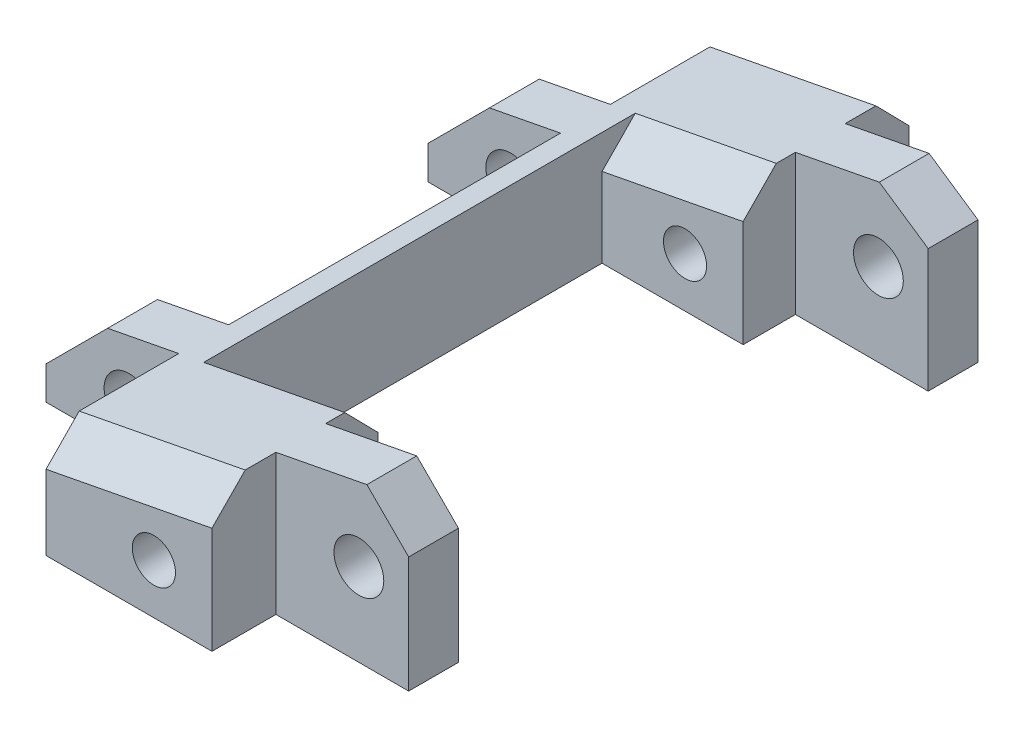
from build123d import *
from OCP.BRepFilletAPI import BRepFilletAPI_MakeChamfer

# Parameters (mm, degrees)
EXTRUDE_1_DEPTH     = 10
SKETCH_2_R          = 1.5
SKETCH_2_R_2        = 1.3
CUT_EXTRUDE_1_DEPTH = 46.08880127
CHAMFER_1_SIZE      = 3
CHAMFER_1_SIZE2     = 3.782343513
CHAMFER_1_SIZE2_2   = 2.562232702
CHAMFER_2_SIZE      = 2


with BuildPart() as part:
    # 草图1 → 凸台-拉伸1 (new body)
    with BuildSketch(Plane(origin=(0, 0, 0), x_dir=(1, 0, 0), z_dir=(0, 1, 0))):
        Polygon((13, -14.15), (5, -14.15), (5, -11), (-3.5, -11), (-3.5, 11), (5, 11), (5, 14.15), (13, 14.15), (13, 17.15), (5, 17.15), (5, 21), (-5, 21), (-5, 13), (-13, 13), (-13, 10), (-5, 10), (-5, -10), (-13, -10), (-13, -13), (-5, -13), (-5, -21), (5, -21), (5, -17.15), (13, -17.15), align=None)
    extrude(amount=EXTRUDE_1_DEPTH)

    # 草图2 → 切除-拉伸1 (cut, through all)
    with BuildSketch(Plane.XY.offset(21)):
        with Locations((10, 5)):
            Circle(SKETCH_2_R)
        with Locations((-8, 2.5)):
            Circle(SKETCH_2_R)
        with Locations((1.5, 3)):
            Circle(SKETCH_2_R_2)
        Polygon((-13, 5), (13, 10), (-13, 10), align=None)
    extrude(amount=-CUT_EXTRUDE_1_DEPTH, mode=Mode.SUBTRACT)

    # 倒角1: one chamfer whose edges measure the first distance from different faces: ONE call of the kernel's chamfer builder (chamfer() names one face for all edges)
    chamfer_1_edges_1 = [part.edges().sort_by_distance(p)[0] for p in [
        (-13, 5, -11.5),
    ]]
    chamfer_1_side_1 = [part.faces().sort_by_distance(p)[0] for p in [
        (-13, 2.5, -11.5),
    ]]
    chamfer_1_edges_2 = [part.edges().sort_by_distance(p)[0] for p in [
        (-13, 5, 11.5),
    ]]
    chamfer_1_side_2 = [part.faces().sort_by_distance(p)[0] for p in [
        (-13, 2.5, 11.5),
    ]]
    chamfer_1_edges_3 = [part.edges().sort_by_distance(p)[0] for p in [
        (13, 10, 15.65),
    ]]
    chamfer_1_side_3 = [part.faces().sort_by_distance(p)[0] for p in [
        (13, 5, 15.65),
    ]]
    chamfer_1_edges_4 = [part.edges().sort_by_distance(p)[0] for p in [
        (13, 10, -15.65),
    ]]
    chamfer_1_side_4 = [part.faces().sort_by_distance(p)[0] for p in [
        (-9, 5.769230769, 12.503512337),
    ]]
    chamfer_1 = BRepFilletAPI_MakeChamfer(part.part.solid().wrapped)
    for e in chamfer_1_edges_1:
        chamfer_1.Add(CHAMFER_1_SIZE, CHAMFER_1_SIZE2, e.wrapped, chamfer_1_side_1[0].wrapped)  # the first distance lies on this face
    for e in chamfer_1_edges_2:
        chamfer_1.Add(CHAMFER_1_SIZE, CHAMFER_1_SIZE2, e.wrapped, chamfer_1_side_2[0].wrapped)  # the first distance lies on this face
    for e in chamfer_1_edges_3:
        chamfer_1.Add(CHAMFER_1_SIZE, CHAMFER_1_SIZE2_2, e.wrapped, chamfer_1_side_3[0].wrapped)  # the first distance lies on this face
    for e in chamfer_1_edges_4:
        chamfer_1.Add(CHAMFER_1_SIZE, CHAMFER_1_SIZE2_2, e.wrapped, chamfer_1_side_4[0].wrapped)  # the first distance lies on this face
    add(Compound.cast(chamfer_1.Shape()), mode=Mode.REPLACE)

    # 倒角2
    chamfer_2_edges = [part.edges().sort_by_distance(p)[0] for p in [
        (0, 7.5, -21),
        (0.75, 7.644230769, 11),
        (0.75, 7.644230769, -11),
        (0, 7.5, 21),
    ]]
    chamfer(chamfer_2_edges, length=CHAMFER_2_SIZE)


solid = part.part
